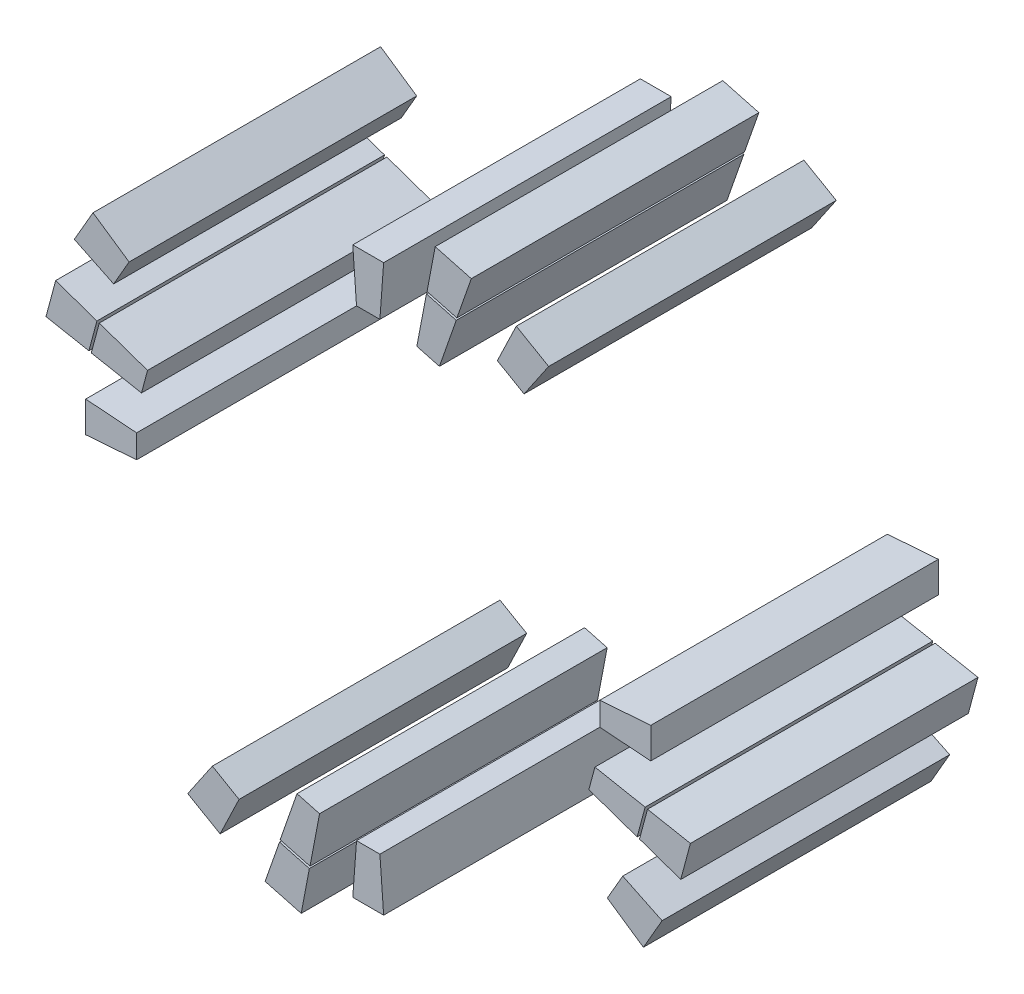
from build123d import *

# Parameters (mm, degrees)
COIL_SIDES_START    = -20
COIL_SIDES_DEPTH    = 40
COIL_SIDES_2_DEPTH  = 40
COIL_SIDES_3_DEPTH  = 40
COIL_SIDES_4_DEPTH  = 40
COIL_SIDES_5_DEPTH  = 40
COIL_SIDES_6_DEPTH  = 40
COIL_SIDES_7_DEPTH  = 40
COIL_SIDES_8_DEPTH  = 40
COIL_SIDES_9_DEPTH  = 40
COIL_SIDES_10_DEPTH = 40
COIL_SIDES_11_DEPTH = 40
COIL_SIDES_12_DEPTH = 40
COIL_SIDES_13_DEPTH = 40
COIL_SIDES_14_DEPTH = 40
COIL_SIDES_15_DEPTH = 40
COIL_SIDES_16_DEPTH = 40


with BuildPart() as part:
    # Эскиз1 → Coil_sides (new body)
    with BuildSketch(Plane.XY.offset(COIL_SIDES_START)):
        Polygon((32.209034059, -1.625), (39.3, -2.147321429), (39.3, 2.147321429), (32.209034059, 1.625), align=None)
    extrude(amount=COIL_SIDES_DEPTH)


with BuildPart() as body_2:
    # Эскиз1 → Coil_sides 2 (new body)
    with BuildSketch(Plane.XY.offset(COIL_SIDES_START)):
        Polygon((21.680577182, 33.25721836), (25.10166605, 38.277360953), (20.59833395, 40.877360953), (17.961307368, 35.404539789), align=None)
    extrude(amount=COIL_SIDES_2_DEPTH)


with BuildPart() as body_3:
    # Эскиз1 → Coil_sides 3 (new body)
    with BuildSketch(Plane.XY.offset(COIL_SIDES_START)):
        Polygon((9.905940906, 30.690956889), (12.245741698, 37.405117291), (8.097435247, 38.516652655), (6.766681971, 31.532118785), align=None)
    extrude(amount=COIL_SIDES_3_DEPTH)


with BuildPart() as body_4:
    # Эскиз1 → Coil_sides 4 (new body)
    with BuildSketch(Plane.XY.offset(COIL_SIDES_START)):
        Polygon((12.334227931, 37.735352408), (14.33943751, 43.469880744), (9.316623213, 44.815739779), (8.18592148, 38.846887771), align=None)
    extrude(amount=COIL_SIDES_4_DEPTH)


with BuildPart() as body_5:
    # Эскиз1 → Coil_sides 5 (new body)
    with BuildSketch(Plane.XY.offset(COIL_SIDES_START)):
        Polygon((1.625, 32.209034059), (2.147321429, 39.3), (-2.147321429, 39.3), (-1.625, 32.209034059), align=None)
    extrude(amount=COIL_SIDES_5_DEPTH)


with BuildPart() as body_6:
    # Эскиз1 → Coil_sides 6 (new body)
    with BuildSketch(Plane.XY.offset(COIL_SIDES_START)):
        Polygon((-33.25721836, 21.680577182), (-38.277360953, 25.10166605), (-40.877360953, 20.59833395), (-35.404539789, 17.961307368), align=None)
    extrude(amount=COIL_SIDES_6_DEPTH)


with BuildPart() as body_7:
    # Эскиз1 → Coil_sides 7 (new body)
    with BuildSketch(Plane.XY.offset(COIL_SIDES_START)):
        Polygon((-30.690956889, 9.905940906), (-37.405117291, 12.245741698), (-38.516652655, 8.097435247), (-31.532118785, 6.766681971), align=None)
    extrude(amount=COIL_SIDES_7_DEPTH)


with BuildPart() as body_8:
    # Эскиз1 → Coil_sides 8 (new body)
    with BuildSketch(Plane.XY.offset(COIL_SIDES_START)):
        Polygon((-37.735352408, 12.334227931), (-43.469880744, 14.33943751), (-44.815739779, 9.316623213), (-38.846887771, 8.18592148), align=None)
    extrude(amount=COIL_SIDES_8_DEPTH)


with BuildPart() as body_9:
    # Эскиз1 → Coil_sides 9 (new body)
    with BuildSketch(Plane.XY.offset(COIL_SIDES_START)):
        Polygon((-32.209034059, 1.625), (-39.3, 2.147321429), (-39.3, -2.147321429), (-32.209034059, -1.625), align=None)
    extrude(amount=COIL_SIDES_9_DEPTH)


with BuildPart() as body_10:
    # Эскиз1 → Coil_sides 10 (new body)
    with BuildSketch(Plane.XY.offset(COIL_SIDES_START)):
        Polygon((-21.680577182, -33.25721836), (-25.10166605, -38.277360953), (-20.59833395, -40.877360953), (-17.961307368, -35.404539789), align=None)
    extrude(amount=COIL_SIDES_10_DEPTH)


with BuildPart() as body_11:
    # Эскиз1 → Coil_sides 11 (new body)
    with BuildSketch(Plane.XY.offset(COIL_SIDES_START)):
        Polygon((-9.905940906, -30.690956889), (-12.245741698, -37.405117291), (-8.097435247, -38.516652655), (-6.766681971, -31.532118785), align=None)
    extrude(amount=COIL_SIDES_11_DEPTH)


with BuildPart() as body_12:
    # Эскиз1 → Coil_sides 12 (new body)
    with BuildSketch(Plane.XY.offset(COIL_SIDES_START)):
        Polygon((-12.334227931, -37.735352408), (-14.33943751, -43.469880744), (-9.316623213, -44.815739779), (-8.18592148, -38.846887771), align=None)
    extrude(amount=COIL_SIDES_12_DEPTH)


with BuildPart() as body_13:
    # Эскиз1 → Coil_sides 13 (new body)
    with BuildSketch(Plane.XY.offset(COIL_SIDES_START)):
        Polygon((-1.625, -32.209034059), (-2.147321429, -39.3), (2.147321429, -39.3), (1.625, -32.209034059), align=None)
    extrude(amount=COIL_SIDES_13_DEPTH)


with BuildPart() as body_14:
    # Эскиз1 → Coil_sides 14 (new body)
    with BuildSketch(Plane.XY.offset(COIL_SIDES_START)):
        Polygon((33.25721836, -21.680577182), (38.277360953, -25.10166605), (40.877360953, -20.59833395), (35.404539789, -17.961307368), align=None)
    extrude(amount=COIL_SIDES_14_DEPTH)


with BuildPart() as body_15:
    # Эскиз1 → Coil_sides 15 (new body)
    with BuildSketch(Plane.XY.offset(COIL_SIDES_START)):
        Polygon((30.690956889, -9.905940906), (37.405117291, -12.245741698), (38.516652655, -8.097435247), (31.532118785, -6.766681971), align=None)
    extrude(amount=COIL_SIDES_15_DEPTH)


with BuildPart() as body_16:
    # Эскиз1 → Coil_sides 16 (new body)
    with BuildSketch(Plane.XY.offset(COIL_SIDES_START)):
        Polygon((37.735352408, -12.334227931), (43.469880744, -14.33943751), (44.815739779, -9.316623213), (38.846887771, -8.18592148), align=None)
    extrude(amount=COIL_SIDES_16_DEPTH)


solid = Compound([part.part, body_2.part, body_3.part, body_4.part, body_5.part, body_6.part, body_7.part, body_8.part, body_9.part, body_10.part, body_11.part, body_12.part, body_13.part, body_14.part, body_15.part, body_16.part])
